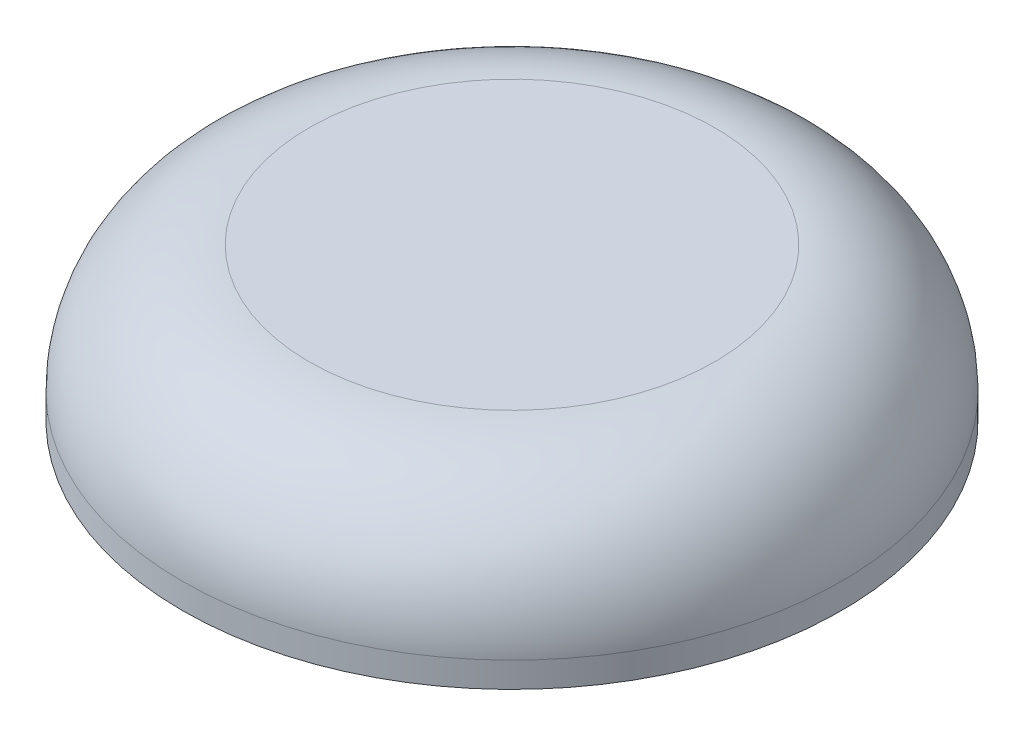
from build123d import *

# Parameters (mm, degrees)
SKETCH1_R           = 6.5
BOSS_EXTRUDE1_DEPTH = 3
FILLET3_R           = 2.5


with BuildPart() as part:
    # Sketch1 → Boss-Extrude1 (new body)
    with BuildSketch(Plane(origin=(0, 0, 0), x_dir=(1, 0, 0), z_dir=(0, 1, 0))):
        with Locations(Location((0, 0, 0), (0, 0, 270))):
            Circle(SKETCH1_R)
    extrude(amount=BOSS_EXTRUDE1_DEPTH)

    # Fillet3
    fillet3_edges = [part.edges().sort_by_distance(p)[0] for p in [
        (0, 3, -6.5),
    ]]
    fillet(fillet3_edges, radius=FILLET3_R)


solid = part.part
